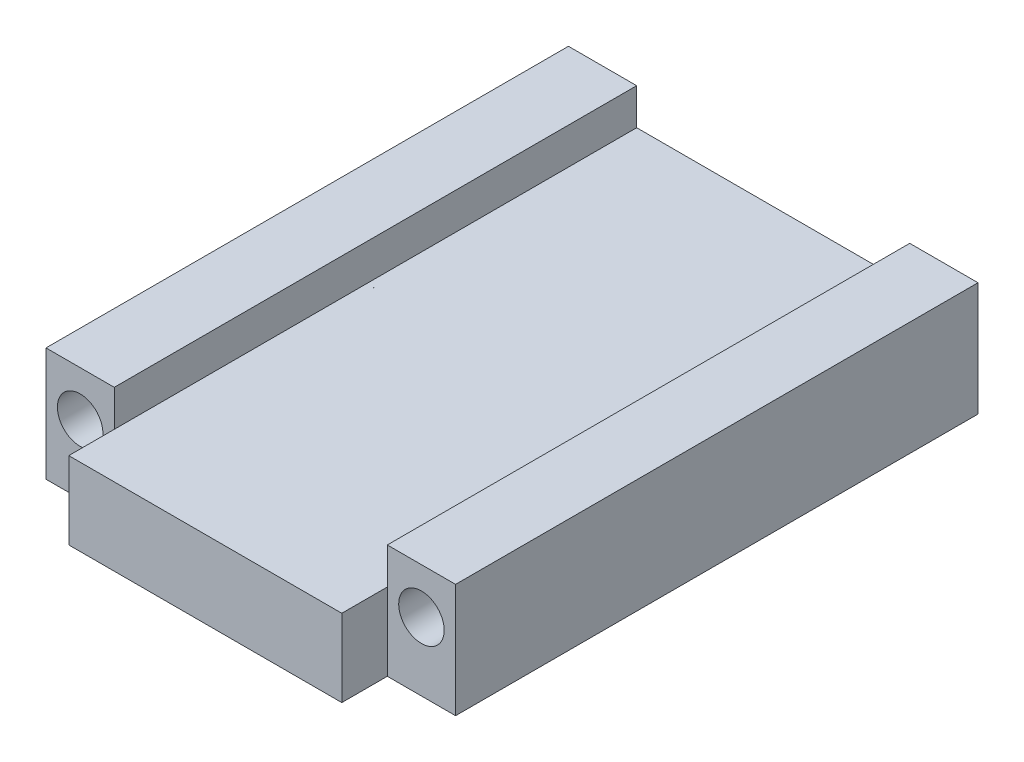
from build123d import *

# Parameters (mm, degrees)
SKETCH1_W                           = 28.575
SKETCH1_H                           = 7.9375
BOSS_EXTRUDE1_DEPTH                 = 39.624
SKETCH2_W                           = 19.05
SKETCH2_H                           = 2.54
CUT_EXTRUDE1_DEPTH                  = 43.307741713
F_1_8_0_125_CLEARANCE_DOWEL_HOLE1_D = 3.175
SKETCH6_W                           = 4.7625
SKETCH6_H                           = 7.9375
CUT_EXTRUDE2_DEPTH                  = 3.175


with BuildPart() as part:
    # Sketch1 → Boss-Extrude1 (new body)
    with BuildSketch(Plane.XY):
        Rectangle(SKETCH1_W, SKETCH1_H)
    extrude(amount=BOSS_EXTRUDE1_DEPTH)

    # Sketch2 → Cut-Extrude1 (cut, through all)
    with BuildSketch(Plane.XY.offset(39.624)):
        with Locations((0, 2.69875)):
            Rectangle(SKETCH2_W, SKETCH2_H)
    extrude(amount=-CUT_EXTRUDE1_DEPTH, mode=Mode.SUBTRACT)

    # 1/8 (0.125) Clearance Dowel Hole1 (through all)
    with Locations(Plane(origin=(0, 0, 0), x_dir=(-1, 0, 0), z_dir=(0, 0, -1))):
        with Locations((-11.90625, 0.79375), (11.90625, 0.79375)):
            Hole(F_1_8_0_125_CLEARANCE_DOWEL_HOLE1_D / 2)

    # Sketch6 → Cut-Extrude2 (cut)
    with BuildSketch(Plane.XY.offset(39.624)):
        with Locations((-11.90625, 0)):
            Rectangle(SKETCH6_W, SKETCH6_H)
        with Locations((11.90625, 0)):
            Rectangle(SKETCH6_W, SKETCH6_H)
    extrude(amount=-CUT_EXTRUDE2_DEPTH, mode=Mode.SUBTRACT)


solid = part.part
